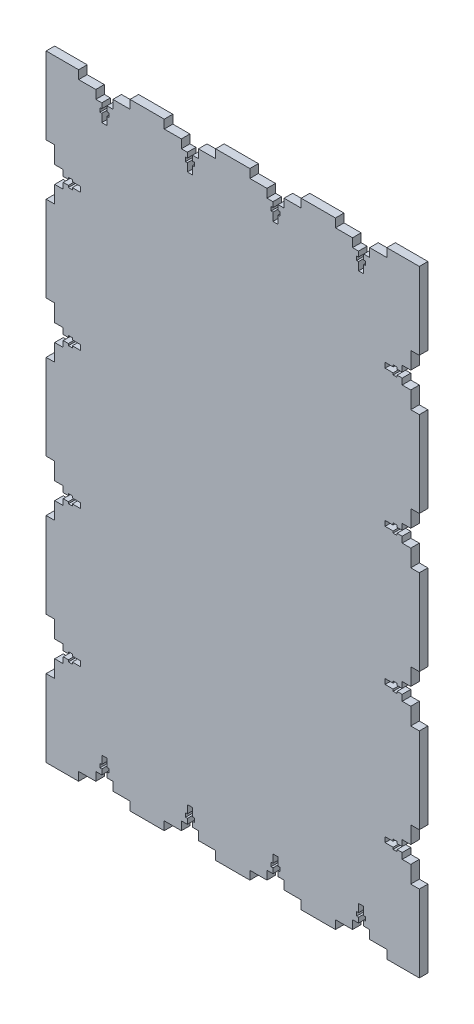
from build123d import *

# Parameters (mm, degrees)
BOSS_EXTRUDE1_DEPTH = 5


with BuildPart() as part:
    # Sketch1 → Boss-Extrude1 (new body)
    with BuildSketch(Plane.XY):
        Polygon((109.464263606, 159.939350886), (90.464263606, 159.939350886), (90.464263606, 154.939350886), (80.464263606, 154.939350886), (80.464263606, 149.939350886), (76.964263606, 149.939350886), (76.964263606, 146.939350886), (78.064263606, 146.939350886), (78.064263606, 144.639350886), (76.964263606, 144.639350886), (76.964263606, 139.939350886), (73.964263606, 139.939350886), (73.964263606, 144.639350886), (72.864263606, 144.639350886), (72.864263606, 146.939350886), (73.964263606, 146.939350886), (73.964263606, 149.939350886), (70.464263606, 149.939350886), (70.464263606, 154.939350886), (60.464263606, 154.939350886), (60.464263606, 159.939350886), (40.464263606, 159.939350886), (40.464263606, 154.939350886), (30.464263606, 154.939350886), (30.464263606, 149.939350886), (26.964263606, 149.939350886), (26.964263606, 146.939350886), (28.064263606, 146.939350886), (28.064263606, 144.639350886), (26.964263606, 144.639350886), (26.964263606, 139.939350886), (23.964263606, 139.939350886), (23.964263606, 144.639350886), (22.864263606, 144.639350886), (22.864263606, 146.939350886), (23.964263606, 146.939350886), (23.964263606, 149.939350886), (20.464263606, 149.939350886), (20.464263606, 154.939350886), (10.464263606, 154.939350886), (10.464263606, 159.939350886), (-9.535736394, 159.939350886), (-9.535736394, 154.939350886), (-19.535736394, 154.939350886), (-19.535736394, 149.939350886), (-23.035736394, 149.939350886), (-23.035736394, 146.939350886), (-21.935736394, 146.939350886), (-21.935736394, 144.639350886), (-23.035736394, 144.639350886), (-23.035736394, 139.939350886), (-26.035736394, 139.939350886), (-26.035736394, 144.639350886), (-27.135736394, 144.639350886), (-27.135736394, 146.939350886), (-26.035736394, 146.939350886), (-26.035736394, 149.939350886), (-29.535736394, 149.939350886), (-29.535736394, 154.939350886), (-39.535736394, 154.939350886), (-39.535736394, 159.939350886), (-59.535736394, 159.939350886), (-59.535736394, 154.939350886), (-69.535736394, 154.939350886), (-69.535736394, 149.939350886), (-73.035736394, 149.939350886), (-73.035736394, 146.939350886), (-71.935736394, 146.939350886), (-71.935736394, 144.639350886), (-73.035736394, 144.639350886), (-73.035736394, 139.939350886), (-76.035736394, 139.939350886), (-76.035736394, 144.639350886), (-77.135736394, 144.639350886), (-77.135736394, 146.939350886), (-76.035736394, 146.939350886), (-76.035736394, 149.939350886), (-79.535736394, 149.939350886), (-79.535736394, 154.939350886), (-89.535736394, 154.939350886), (-89.535736394, 159.939350886), (-108.535736394, 159.939350886), (-108.535736394, 114.939350886), (-103.535736394, 114.939350886), (-103.535736394, 104.939350886), (-98.535736394, 104.939350886), (-98.535736394, 101.439350886), (-95.535736394, 101.439350886), (-95.535736394, 102.539350886), (-93.235736394, 102.539350886), (-93.235736394, 101.439350886), (-88.535736394, 101.439350886), (-88.535736394, 98.439350886), (-93.235736394, 98.439350886), (-93.235736394, 97.339350886), (-95.535736394, 97.339350886), (-95.535736394, 98.439350886), (-98.535736394, 98.439350886), (-98.535736394, 94.939350886), (-103.535736394, 94.939350886), (-103.535736394, 84.939350886), (-108.535736394, 84.939350886), (-108.535736394, 34.939350886), (-103.535736394, 34.939350886), (-103.535736394, 24.939350886), (-98.535736394, 24.939350886), (-98.535736394, 21.439350886), (-95.535736394, 21.439350886), (-95.535736394, 22.539350886), (-93.235736394, 22.539350886), (-93.235736394, 21.439350886), (-88.535736394, 21.439350886), (-88.535736394, 18.439350886), (-93.235736394, 18.439350886), (-93.235736394, 17.339350886), (-95.535736394, 17.339350886), (-95.535736394, 18.439350886), (-98.535736394, 18.439350886), (-98.535736394, 14.939350886), (-103.535736394, 14.939350886), (-103.535736394, 4.939350886), (-108.535736394, 4.939350886), (-108.535736394, -45.060649114), (-103.535736394, -45.060649114), (-103.535736394, -55.060649114), (-98.535736394, -55.060649114), (-98.535736394, -58.560649114), (-95.535736394, -58.560649114), (-95.535736394, -57.460649114), (-93.235736394, -57.460649114), (-93.235736394, -58.560649114), (-88.535736394, -58.560649114), (-88.535736394, -61.560649114), (-93.235736394, -61.560649114), (-93.235736394, -62.660649114), (-95.535736394, -62.660649114), (-95.535736394, -61.560649114), (-98.535736394, -61.560649114), (-98.535736394, -65.060649114), (-103.535736394, -65.060649114), (-103.535736394, -75.060649114), (-108.535736394, -75.060649114), (-108.535736394, -125.060649114), (-103.535736394, -125.060649114), (-103.535736394, -135.060649114), (-98.535736394, -135.060649114), (-98.535736394, -138.560649114), (-95.535736394, -138.560649114), (-95.535736394, -137.460649114), (-93.235736394, -137.460649114), (-93.235736394, -138.560649114), (-88.535736394, -138.560649114), (-88.535736394, -141.560649114), (-93.235736394, -141.560649114), (-93.235736394, -142.660649114), (-95.535736394, -142.660649114), (-95.535736394, -141.560649114), (-98.535736394, -141.560649114), (-98.535736394, -145.060649114), (-103.535736394, -145.060649114), (-103.535736394, -155.060649114), (-108.535736394, -155.060649114), (-108.535736394, -200.060649114), (-89.535736394, -200.060649114), (-89.535736394, -195.060649114), (-79.535736394, -195.060649114), (-79.535736394, -190.060649114), (-76.035736394, -190.060649114), (-76.035736394, -187.060649114), (-77.135736394, -187.060649114), (-77.135736394, -184.760649114), (-76.035736394, -184.760649114), (-76.035736394, -180.060649114), (-73.035736394, -180.060649114), (-73.035736394, -184.760649114), (-71.935736394, -184.760649114), (-71.935736394, -187.060649114), (-73.035736394, -187.060649114), (-73.035736394, -190.060649114), (-69.535736394, -190.060649114), (-69.535736394, -195.060649114), (-59.535736394, -195.060649114), (-59.535736394, -200.060649114), (-39.535736394, -200.060649114), (-39.535736394, -195.060649114), (-29.535736394, -195.060649114), (-29.535736394, -190.060649114), (-26.035736394, -190.060649114), (-26.035736394, -187.060649114), (-27.135736394, -187.060649114), (-27.135736394, -184.760649114), (-26.035736394, -184.760649114), (-26.035736394, -180.060649114), (-23.035736394, -180.060649114), (-23.035736394, -184.760649114), (-21.935736394, -184.760649114), (-21.935736394, -187.060649114), (-23.035736394, -187.060649114), (-23.035736394, -190.060649114), (-19.535736394, -190.060649114), (-19.535736394, -195.060649114), (-9.535736394, -195.060649114), (-9.535736394, -200.060649114), (10.464263606, -200.060649114), (10.464263606, -195.060649114), (20.464263606, -195.060649114), (20.464263606, -190.060649114), (23.964263606, -190.060649114), (23.964263606, -187.060649114), (22.864263606, -187.060649114), (22.864263606, -184.760649114), (23.964263606, -184.760649114), (23.964263606, -180.060649114), (26.964263606, -180.060649114), (26.964263606, -184.760649114), (28.064263606, -184.760649114), (28.064263606, -187.060649114), (26.964263606, -187.060649114), (26.964263606, -190.060649114), (30.464263606, -190.060649114), (30.464263606, -195.060649114), (40.464263606, -195.060649114), (40.464263606, -200.060649114), (60.464263606, -200.060649114), (60.464263606, -195.060649114), (70.464263606, -195.060649114), (70.464263606, -190.060649114), (73.964263606, -190.060649114), (73.964263606, -187.060649114), (72.864263606, -187.060649114), (72.864263606, -184.760649114), (73.964263606, -184.760649114), (73.964263606, -180.060649114), (76.964263606, -180.060649114), (76.964263606, -184.760649114), (78.064263606, -184.760649114), (78.064263606, -187.060649114), (76.964263606, -187.060649114), (76.964263606, -190.060649114), (80.464263606, -190.060649114), (80.464263606, -195.060649114), (90.464263606, -195.060649114), (90.464263606, -200.060649114), (109.464263606, -200.060649114), (109.464263606, -155.060649114), (104.464263606, -155.060649114), (104.464263606, -145.060649114), (99.464263606, -145.060649114), (99.464263606, -141.560649114), (96.464263606, -141.560649114), (96.464263606, -142.660649114), (94.164263606, -142.660649114), (94.164263606, -141.560649114), (89.464263606, -141.560649114), (89.464263606, -138.560649114), (94.164263606, -138.560649114), (94.164263606, -137.460649114), (96.464263606, -137.460649114), (96.464263606, -138.560649114), (99.464263606, -138.560649114), (99.464263606, -135.060649114), (104.464263606, -135.060649114), (104.464263606, -125.060649114), (109.464263606, -125.060649114), (109.464263606, -75.060649114), (104.464263606, -75.060649114), (104.464263606, -65.060649114), (99.464263606, -65.060649114), (99.464263606, -61.560649114), (96.464263606, -61.560649114), (96.464263606, -62.660649114), (94.164263606, -62.660649114), (94.164263606, -61.560649114), (89.464263606, -61.560649114), (89.464263606, -58.560649114), (94.164263606, -58.560649114), (94.164263606, -57.460649114), (96.464263606, -57.460649114), (96.464263606, -58.560649114), (99.464263606, -58.560649114), (99.464263606, -55.060649114), (104.464263606, -55.060649114), (104.464263606, -45.060649114), (109.464263606, -45.060649114), (109.464263606, 4.939350886), (104.464263606, 4.939350886), (104.464263606, 14.939350886), (99.464263606, 14.939350886), (99.464263606, 18.439350886), (96.464263606, 18.439350886), (96.464263606, 17.339350886), (94.164263606, 17.339350886), (94.164263606, 18.439350886), (89.464263606, 18.439350886), (89.464263606, 21.439350886), (94.164263606, 21.439350886), (94.164263606, 22.539350886), (96.464263606, 22.539350886), (96.464263606, 21.439350886), (99.464263606, 21.439350886), (99.464263606, 24.939350886), (104.464263606, 24.939350886), (104.464263606, 34.939350886), (109.464263606, 34.939350886), (109.464263606, 84.939350886), (104.464263606, 84.939350886), (104.464263606, 94.939350886), (99.464263606, 94.939350886), (99.464263606, 98.439350886), (96.464263606, 98.439350886), (96.464263606, 97.339350886), (94.164263606, 97.339350886), (94.164263606, 98.439350886), (89.464263606, 98.439350886), (89.464263606, 101.439350886), (94.164263606, 101.439350886), (94.164263606, 102.539350886), (96.464263606, 102.539350886), (96.464263606, 101.439350886), (99.464263606, 101.439350886), (99.464263606, 104.939350886), (104.464263606, 104.939350886), (104.464263606, 114.939350886), (109.464263606, 114.939350886), align=None)
    extrude(amount=BOSS_EXTRUDE1_DEPTH)


solid = part.part
